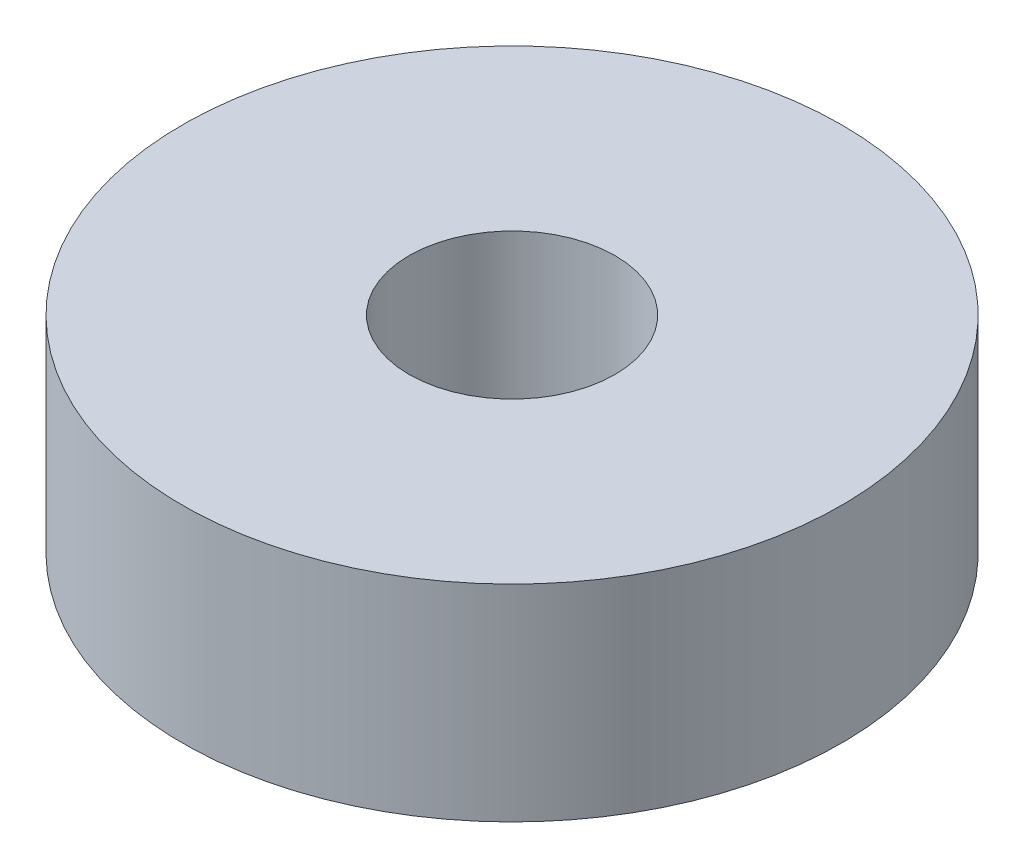
from build123d import *

# Parameters (mm, degrees)
ESQUISSE1_W = 5.5
ESQUISSE1_H = 5


with BuildPart() as part:
    # Esquisse1 → Révolution1 (revolve)
    with BuildSketch(Plane.XY, mode=Mode.PRIVATE) as r_volution1_sk:
        with Locations((5.25, 0)):
            Rectangle(ESQUISSE1_W, ESQUISSE1_H)
    revolve(r_volution1_sk.sketch.rotate(Axis((0, -2.39881159, 0), (0, 1, 0)), 90), axis=Axis((0, -2.39881159, 0), (0, 1, 0)))


solid = part.part
